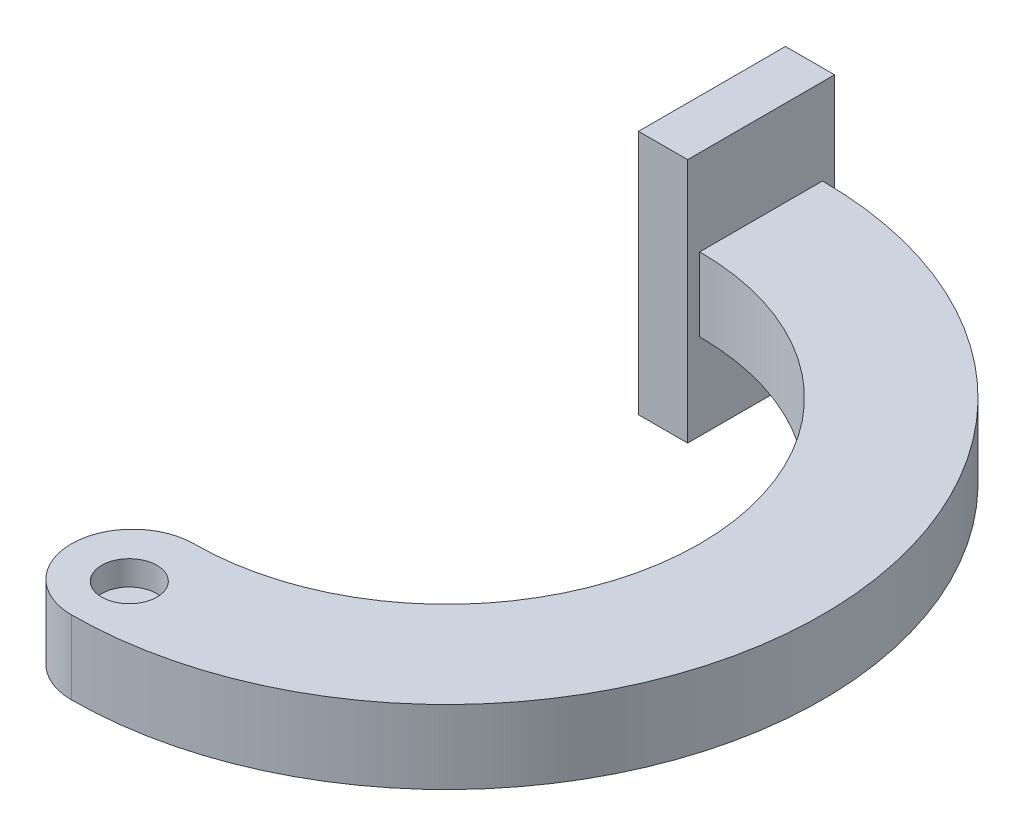
from build123d import *

# Parameters (mm, degrees)
BOSS_EXTRUDE1_DEPTH = 3
SKETCH2_R           = 2.25
CUT_EXTRUDE1_DEPTH  = 2
SKETCH4_W           = 11.97211786
SKETCH4_H           = 20
BOSS_EXTRUDE3_DEPTH = 4


with BuildPart() as part:
    # Sketch1 → Boss-Extrude1 (new, symmetric)
    with BuildSketch(Plane(origin=(0, 0, 0), x_dir=(1, 0, 0), z_dir=(0, 1, 0))):
        with BuildLine():
            Line((0, 61.2), (0, 51.2))
            ThreePointArc((0, 51.2), (20.599999205, 30.599999922), (-1.55e-07, 10))
            ThreePointArc((-1.55e-07, 10), (-5, 4.999999922), (0, 0))
            ThreePointArc((0, 0), (30.6, 30.6), (0, 61.2))
        make_face()
    extrude(amount=BOSS_EXTRUDE1_DEPTH, both=True)

    # Sketch2 → Cut-Extrude1 (cut)
    with BuildSketch(Plane(origin=(0, 3, 0), x_dir=(1, 0, 0), z_dir=(0, 1, 0))):
        with Locations(Location((0, 4.727516706, 0), (0, 0, 270))):
            Circle(SKETCH2_R)
    extrude(amount=-CUT_EXTRUDE1_DEPTH, mode=Mode.SUBTRACT)

    # Sketch4 → Boss-Extrude3 (add)
    with BuildSketch(Plane.ZY):
        with Locations((-56.2, 0)):
            Rectangle(SKETCH4_W, SKETCH4_H)
    extrude(amount=BOSS_EXTRUDE3_DEPTH)


solid = part.part
